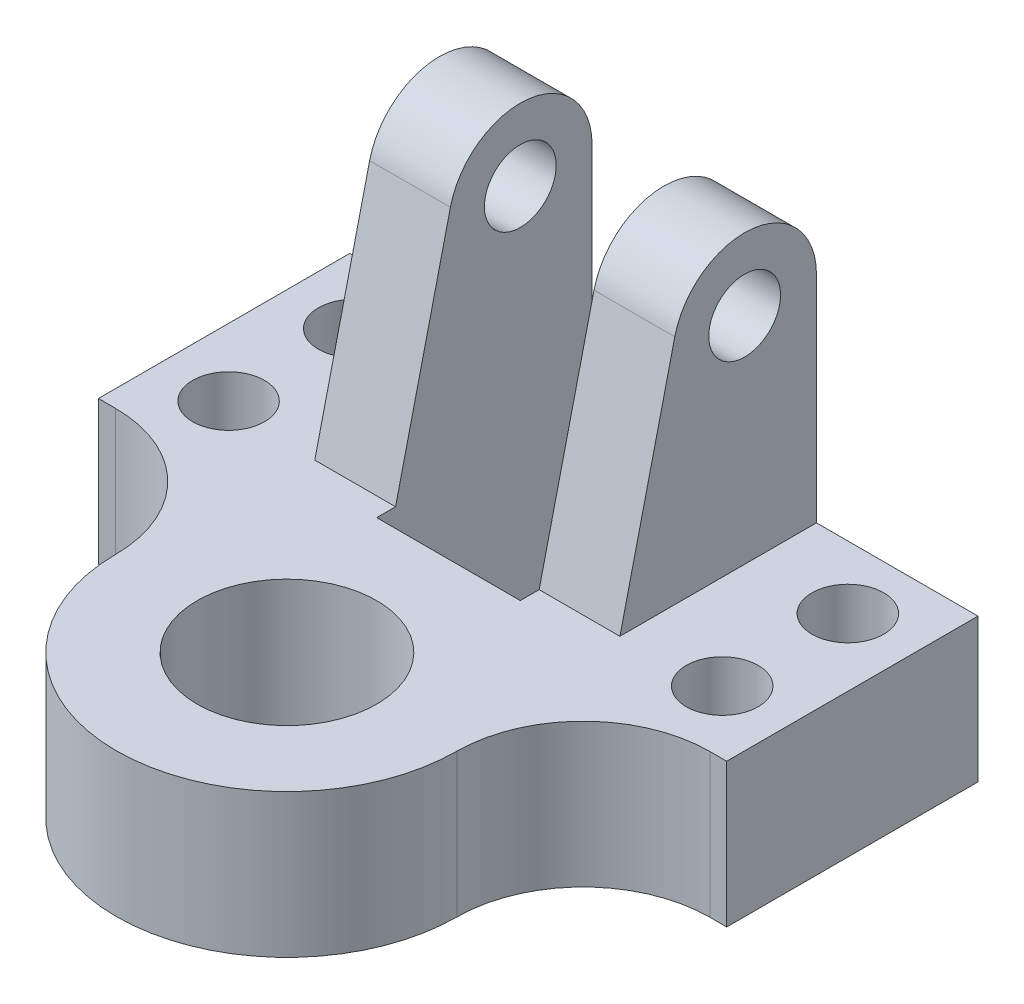
from build123d import *

# Parameters (mm, degrees)
SKETCH_1_R      = 508
SKETCH_1_R_2    = 203.2
EXTRUDE_1_DEPTH = 812.8
FILLET_3_R      = 717.55
SKETCH_5_R      = 203.2
EXTRUDE_4_DEPTH = 457.2


with BuildPart() as part:
    # 草图1 → 凸台-拉伸1 (new body)
    with BuildSketch(Plane(origin=(0, 0, 0), x_dir=(1, 0, 0), z_dir=(0, 1, 0))):
        with BuildLine():
            Line((-578.277634848, -1422.4), (-578.277634848, -2133.6))
            ThreePointArc((-578.277634848, -2133.6), (386.922365152, -3098.8), (1352.122365152, -2133.6))
            Line((1352.122365152, -2133.6), (1352.122365152, -1422.4))
            Line((1352.122365152, -1422.4), (2164.922365152, -1422.4))
            Line((2164.922365152, -1422.4), (2164.922365152, 0))
            Line((2164.922365152, 0), (793.322365152, 0))
            Line((793.322365152, 0), (793.322365152, -1219.2))
            Line((793.322365152, -1219.2), (-19.477634848, -1219.2))
            Line((-19.477634848, -1219.2), (-19.477634848, 0))
            Line((-19.477634848, 0), (-1391.077634848, 0))
            Line((-1391.077634848, 0), (-1391.077634848, -1422.4))
            Line((-1391.077634848, -1422.4), (-578.277634848, -1422.4))
        make_face()
        with Locations(Location((386.922365152, -2133.6, 0), (0, 0, 270))):
            Circle(SKETCH_1_R, mode=Mode.SUBTRACT)
        with Locations(Location((1783.922365152, -1066.8, 0), (0, 0, 270))):
            Circle(SKETCH_1_R_2, mode=Mode.SUBTRACT)
        with Locations(Location((1783.922365152, -355.6, 0), (0, 0, 270))):
            Circle(SKETCH_1_R_2, mode=Mode.SUBTRACT)
        with Locations(Location((-1010.077634848, -1066.8, 0), (0, 0, 270))):
            Circle(SKETCH_1_R_2, mode=Mode.SUBTRACT)
        with Locations(Location((-1010.077634848, -355.6, 0), (0, 0, 270))):
            Circle(SKETCH_1_R_2, mode=Mode.SUBTRACT)
    extrude(amount=EXTRUDE_1_DEPTH)

    # 圆角3
    fillet_3_edges = [part.edges().sort_by_distance(p)[0] for p in [
        (1352.122365152, 406.4, 1422.4),
        (-578.277634848, 406.4, 1422.4),
    ]]
    fillet(fillet_3_edges, radius=FILLET_3_R)

    # 草图5 → 凸台-拉伸4 (add)
    with BuildSketch(Plane.ZY.offset(-793.322365152)):
        with BuildLine():
            Line((0, 812.8), (0, 2032))
            ThreePointArc((0, 2032), (359.311227426, 2435.662739793), (801.887832172, 2125.543223183))
            Line((801.887832172, 2125.543223183), (1112.385962125, 812.8))
            Line((1112.385962125, 812.8), (0, 812.8))
        make_face()
        with Locations((406.4, 2032)):
            Circle(SKETCH_5_R, mode=Mode.SUBTRACT)
    extrude_4 = extrude(amount=-EXTRUDE_4_DEPTH)

    # 镜向1: 凸台-拉伸4 across plane
    add(extrude_4.mirror(Plane.ZY.offset(-386.922365152)))


solid = part.part
